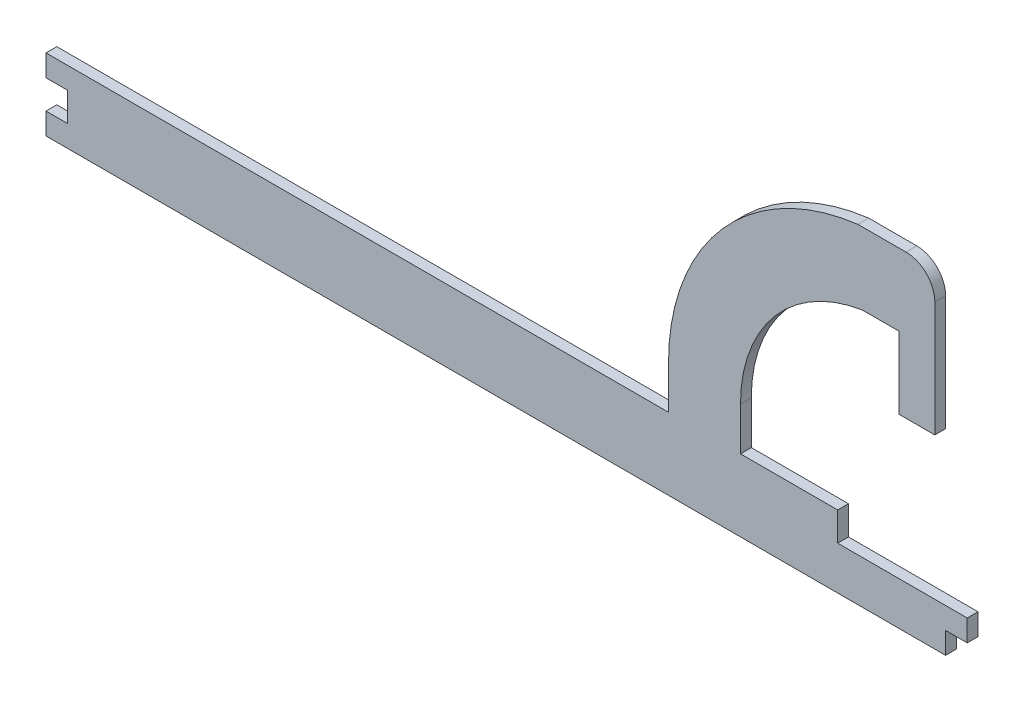
from build123d import *

# Parameters (mm, degrees)
EXTRUDE_1_DEPTH = 3


with BuildPart() as part:
    # Эскиз2 → Бобышка-Вытянуть1 (new body)
    with BuildSketch(Plane.XY):
        with BuildLine():
            Line((0, 0), (244, 0))
            Line((244, 0), (244, 6))
            Line((244, 6), (250, 6))
            Line((250, 6), (250, 12))
            Line((250, 12), (244, 12))
            Line((244, 12), (214, 12))
            Line((214, 12), (214, 20))
            Line((214, 20), (187, 20))
            Line((187, 20), (187, 32))
            ThreePointArc((187, 32), (196.668498224, 58.076809621), (221, 71.547439867))
            Line((221, 71.547439867), (231, 71.547439867))
            Line((231, 71.547439867), (231, 51.547439867))
            Line((231, 51.547439867), (241, 51.547439867))
            Line((241, 51.547439867), (241, 83.547439867))
            ThreePointArc((241, 83.547439867), (238.656854249, 89.204294116), (233, 91.547439867))
            Line((233, 91.547439867), (219.644566271, 91.547439867))
            ThreePointArc((219.644566271, 91.547439867), (182.048214587, 71.740873017), (167, 32))
            Line((167, 32), (167, 20))
            Line((167, 20), (0, 20))
            Line((0, 20), (-6, 20))
            Line((-6, 20), (-6, 14))
            Line((-6, 14), (0, 14))
            Line((0, 14), (0, 6))
            Line((0, 6), (-6, 6))
            Line((-6, 6), (-6, 0))
            Line((-6, 0), (0, 0))
        make_face()
    extrude(amount=EXTRUDE_1_DEPTH)


solid = part.part
